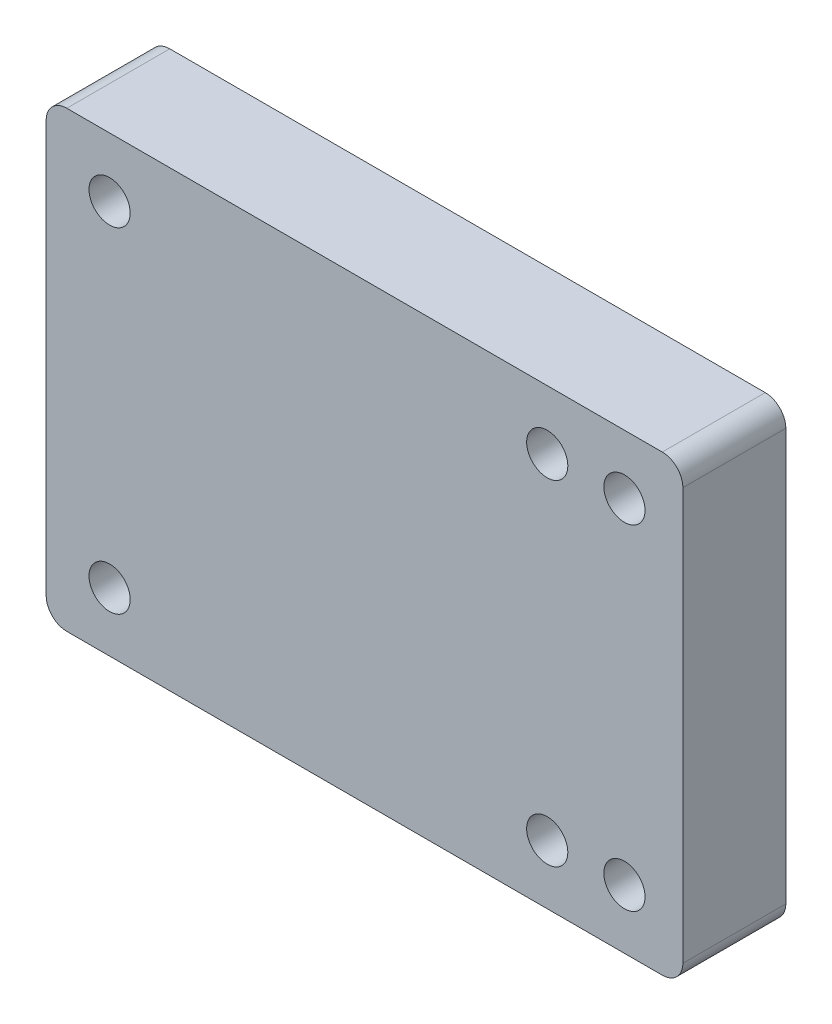
from build123d import *

# Parameters (mm, degrees)
SKETCH1_R           = 2.54
BOSS_EXTRUDE1_DEPTH = 12.7


with BuildPart() as part:
    # Sketch1 → Boss-Extrude1 (new body)
    with BuildSketch(Plane.XY):
        with BuildLine():
            Line((120.167455723, 128.44), (46.723424496, 128.44))
            add(Edge.make_bspline(
                [(46.723424496, 128.44), (44.179938737, 128.44), (44.179938737, 125.9)],
                knots=[1.570796327, 1.570796327, 1.570796327, 3.141592654, 3.141592654, 3.141592654], degree=2, weights=[1, 0.707106781, 1]))
            Line((44.179938737, 125.9), (44.179938737, 75.1))
            add(Edge.make_bspline(
                [(44.179938737, 75.1), (44.179938737, 72.56), (46.723424496, 72.56)],
                knots=[3.141592654, 3.141592654, 3.141592654, 4.71238898, 4.71238898, 4.71238898], degree=2, weights=[1, 0.707106781, 1]))
            Line((46.723424496, 72.56), (120.167455723, 72.56))
            ThreePointArc((120.167455723, 72.56), (121.963506947, 73.303948776), (122.707455723, 75.1))
            Line((122.707455723, 75.1), (122.707455723, 125.9))
            ThreePointArc((122.707455723, 125.9), (121.963506947, 127.696051224), (120.167455723, 128.44))
        make_face()
        with Locations((105.978138737, 79.8625)):
            Circle(SKETCH1_R, mode=Mode.SUBTRACT)
        with Locations((115.503138737, 79.8625)):
            Circle(SKETCH1_R, mode=Mode.SUBTRACT)
        with Locations((115.503138737, 121.1375)):
            Circle(SKETCH1_R, mode=Mode.SUBTRACT)
        with Locations((105.978138737, 121.1375)):
            Circle(SKETCH1_R, mode=Mode.SUBTRACT)
        with Locations((52.003138737, 121.1375)):
            Circle(SKETCH1_R, mode=Mode.SUBTRACT)
        with Locations((52.003138737, 79.8625)):
            Circle(SKETCH1_R, mode=Mode.SUBTRACT)
    extrude(amount=BOSS_EXTRUDE1_DEPTH)


solid = part.part
